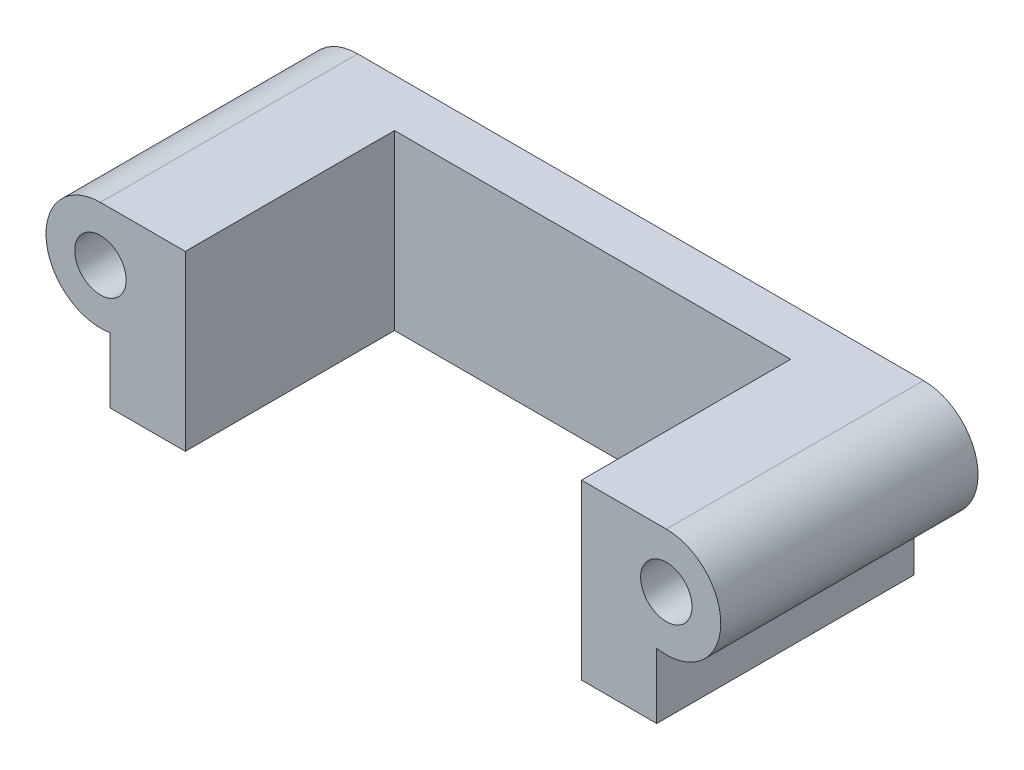
from build123d import *

# Parameters (mm, degrees)
ESBO_O1_R                  = 1.5
RESSALTO_EXTRUS_O1_DEPTH   = 15
CORTE_EXTRUS_O1_DEPTH      = 40.769162048
CORTE_EXTRUS_O1_DEPTH_BACK = 40.769162048
ESBO_O2_W                  = 23.1
ESBO_O2_H                  = 12.2


with BuildPart() as part:
    # Esboço1 → Ressalto-extrusão1 (new body)
    with BuildSketch(Plane.XY):
        with BuildLine():
            Line((0, 3.175), (33, 3.175))
            ThreePointArc((33, 3.175), (36.162475296, -0.281735692), (32.438751392, -3.125))
            Line((32.438751392, -3.125), (32.438751392, -6.925))
            Line((32.438751392, -6.925), (0.561248608, -6.925))
            Line((0.561248608, -6.925), (0.561248608, -3.125))
            ThreePointArc((0.561248608, -3.125), (-3.162475296, -0.281735692), (0, 3.175))
        make_face()
        Circle(ESBO_O1_R, mode=Mode.SUBTRACT)
        with Locations((33, 0)):
            Circle(ESBO_O1_R, mode=Mode.SUBTRACT)
    extrude(amount=RESSALTO_EXTRUS_O1_DEPTH)

    # Esboço2 → Corte-extrusão1 (cut, two sides: drawn at the far end of the back side and taken through both)
    with BuildSketch(Plane(origin=(0, 0, 0), x_dir=(1, 0, 0), z_dir=(0, 1, 0)).offset(-CORTE_EXTRUS_O1_DEPTH_BACK)):
        with Locations((16.5, -8.9)):
            Rectangle(ESBO_O2_W, ESBO_O2_H)
    extrude(amount=CORTE_EXTRUS_O1_DEPTH + CORTE_EXTRUS_O1_DEPTH_BACK, mode=Mode.SUBTRACT)


solid = part.part
